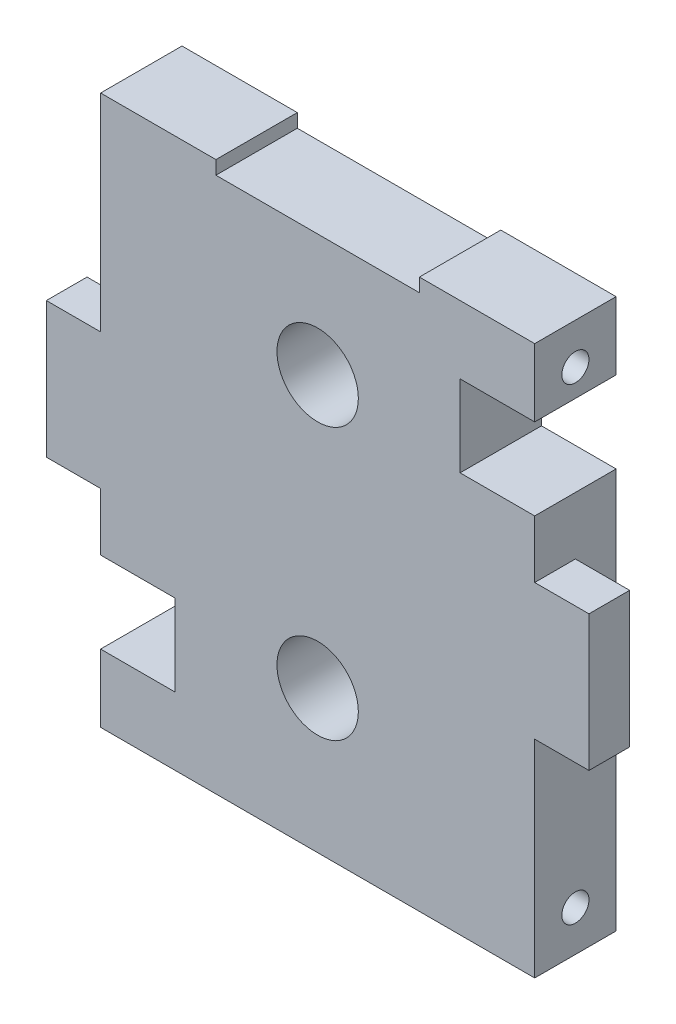
from build123d import *

# Parameters (mm, degrees)
SKETCH_1_R          = 3
EXTRUDE_1_DEPTH     = 3
EXTRUDE_START       = -6
SKETCH_2_R          = 3
EXTRUDE_2_DEPTH     = 6
SKETCH_3_R          = 1
CUT_EXTRUDE_1_DEPTH = 55.270157545
SKETCH_6_W          = 15
SKETCH_6_H          = 1
CUT_EXTRUDE_5_DEPTH = 10


with BuildPart() as part:
    # 草图1 → 凸台-拉伸1 (new body)
    with BuildSketch(Plane.XY):
        Polygon((0, 0), (0, -15.25), (-4, -15.25), (-4, -25.25), (0, -25.25), (0, -29.5), (5.5, -29.5), (5.5, -35.5), (0, -35.5), (0, -40.5), (32, -40.5), (32, -25.25), (36, -25.25), (36, -15.25), (32, -15.25), (32, -11), (26.5, -11), (26.5, -5), (32, -5), (32, 0), align=None)
        with Locations((16, -10)):
            Circle(SKETCH_1_R, mode=Mode.SUBTRACT)
        with Locations((16, -30)):
            Circle(SKETCH_1_R, mode=Mode.SUBTRACT)
    extrude(amount=EXTRUDE_1_DEPTH)

    # 草图2 → 凸台-拉伸2 (add)
    with BuildSketch(Plane.XY.offset(3).offset(EXTRUDE_START)):
        Polygon((0, 0), (0, -29.5), (5.5, -29.5), (5.5, -35.5), (0, -35.5), (0, -40.5), (32, -40.5), (32, -11), (26.5, -11), (26.5, -5), (32, -5), (32, 0), align=None)
        with Locations((16, -10)):
            Circle(SKETCH_2_R, mode=Mode.SUBTRACT)
        with Locations((16, -30)):
            Circle(SKETCH_2_R, mode=Mode.SUBTRACT)
    extrude(amount=EXTRUDE_2_DEPTH)

    # 草图3 → 切除-拉伸1 (cut, through all)
    with BuildSketch(Plane(origin=(32, 0, 0), x_dir=(0, 0, -1), z_dir=(1, 0, 0))):
        with Locations((0, -3)):
            Circle(SKETCH_3_R)
        with Locations((0, -37.5)):
            Circle(SKETCH_3_R)
    extrude(amount=-CUT_EXTRUDE_1_DEPTH, mode=Mode.SUBTRACT)

    # 草图6 → 切除-拉伸5 (cut)
    with BuildSketch(Plane.XY.offset(3)):
        with Locations((16, -0.5)):
            Rectangle(SKETCH_6_W, SKETCH_6_H)
    extrude(amount=-CUT_EXTRUDE_5_DEPTH, mode=Mode.SUBTRACT)


solid = part.part
